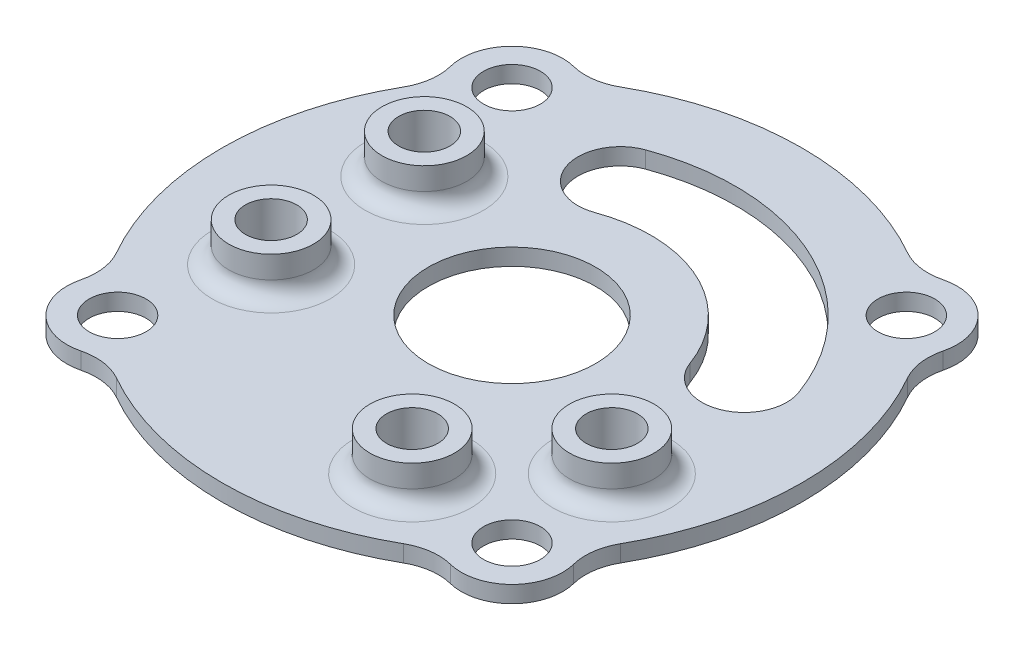
from build123d import *

# Parameters (mm, degrees)
SKETCH1_R           = 5.1
SKETCH1_R_2         = 4.6
BOSS_EXTRUDE1_DEPTH = 3
SKETCH2_R           = 7.6
SKETCH2_R_2         = 4.6
BOSS_EXTRUDE2_DEPTH = 7
FILLET1_R           = 10
FILLET2_R           = 3
SKETCH3_R           = 15
CUT_EXTRUDE1_DEPTH  = 7
CUT_EXTRUDE2_DEPTH  = 7


with BuildPart() as part:
    # Sketch1 → Boss-Extrude1 (new body)
    with BuildSketch(Plane(origin=(0, 0, 0), x_dir=(1, 0, 0), z_dir=(0, 1, 0))):
        with BuildLine():
            ThreePointArc((-42.589636172, 29.834927363), (-52, 0), (-42.589636172, -29.834927363))
            ThreePointArc((-42.589636172, -29.834927363), (-41.790010768, -41.790010768), (-29.834927363, -42.589636172))
            ThreePointArc((-29.834927363, -42.589636172), (0, -52), (29.834927363, -42.589636172))
            ThreePointArc((29.834927363, -42.589636172), (41.790010768, -41.790010768), (42.589636172, -29.834927363))
            ThreePointArc((42.589636172, -29.834927363), (52, 0), (42.589636172, 29.834927363))
            ThreePointArc((42.589636172, 29.834927363), (41.790010768, 41.790010768), (29.834927363, 42.589636172))
            ThreePointArc((29.834927363, 42.589636172), (0, 52), (-29.834927363, 42.589636172))
            ThreePointArc((-29.834927363, 42.589636172), (-41.790010768, 41.790010768), (-42.589636172, 29.834927363))
        make_face()
        with Locations(Location((-35.355339059, -35.355339059, 0), (0, 0, 270))):
            Circle(SKETCH1_R, mode=Mode.SUBTRACT)
        with Locations(Location((-29.455003079, -13.735093507, 0), (0, 0, 270))):
            Circle(SKETCH1_R_2, mode=Mode.SUBTRACT)
        with Locations(Location((15.636875684, -33.53338812, 0), (0, 0, 270))):
            Circle(SKETCH1_R_2, mode=Mode.SUBTRACT)
        with Locations(Location((35.355339059, -35.355339059, 0), (0, 0, 270))):
            Circle(SKETCH1_R, mode=Mode.SUBTRACT)
        with Locations(Location((33.53338812, -15.636875684, 0), (0, 0, 270))):
            Circle(SKETCH1_R_2, mode=Mode.SUBTRACT)
        with Locations(Location((-29.455003079, 13.735093507, 0), (0, 0, 270))):
            Circle(SKETCH1_R_2, mode=Mode.SUBTRACT)
        with Locations(Location((-35.355339059, 35.355339059, 0), (0, 0, 270))):
            Circle(SKETCH1_R, mode=Mode.SUBTRACT)
        with Locations(Location((35.355339059, 35.355339059, 0), (0, 0, 270))):
            Circle(SKETCH1_R, mode=Mode.SUBTRACT)
    extrude(amount=BOSS_EXTRUDE1_DEPTH)

    # Sketch2 → Boss-Extrude2 (add)
    # profile 1 of 4: a face of its own
    with BuildSketch(Plane(origin=(0, 3, 0), x_dir=(1, 0, 0), z_dir=(0, 1, 0))):
        with Locations(Location((-29.455003079, 13.735093507, 0), (0, 0, 270))):
            Circle(SKETCH2_R)
        with Locations(Location((-29.455003079, 13.735093507, 0), (0, 0, 270))):
            Circle(SKETCH2_R_2, mode=Mode.SUBTRACT)
    # profile 2 of 4: a face of its own
    with BuildSketch(Plane(origin=(0, 3, 0), x_dir=(1, 0, 0), z_dir=(0, 1, 0))):
        with Locations(Location((-29.455003079, -13.735093507, 0), (0, 0, 270))):
            Circle(SKETCH2_R)
        with Locations(Location((-29.455003079, -13.735093507, 0), (0, 0, 270))):
            Circle(SKETCH2_R_2, mode=Mode.SUBTRACT)
    # profile 3 of 4: a face of its own
    with BuildSketch(Plane(origin=(0, 3, 0), x_dir=(1, 0, 0), z_dir=(0, 1, 0))):
        with Locations(Location((15.636875684, -33.53338812, 0), (0, 0, 270))):
            Circle(SKETCH2_R)
        with Locations(Location((15.636875684, -33.53338812, 0), (0, 0, 270))):
            Circle(SKETCH2_R_2, mode=Mode.SUBTRACT)
    # profile 4 of 4: a face of its own
    with BuildSketch(Plane(origin=(0, 3, 0), x_dir=(1, 0, 0), z_dir=(0, 1, 0))):
        with Locations(Location((33.53338812, -15.636875684, 0), (0, 0, 270))):
            Circle(SKETCH2_R)
        with Locations(Location((33.53338812, -15.636875684, 0), (0, 0, 270))):
            Circle(SKETCH2_R_2, mode=Mode.SUBTRACT)
    extrude(amount=BOSS_EXTRUDE2_DEPTH)

    # Fillet1
    fillet1_edges = [part.edges().sort_by_distance(p)[0] for p in [
        (-42.589636172, 1.5, 29.834927363),
        (-42.589636172, 1.5, -29.834927363),
        (-29.834927363, 1.5, -42.589636172),
        (29.834927363, 1.5, -42.589636172),
        (42.589636172, 1.5, -29.834927363),
        (42.589636172, 1.5, 29.834927363),
        (29.834927363, 1.5, 42.589636172),
        (-29.834927363, 1.5, 42.589636172),
    ]]
    fillet(fillet1_edges, radius=FILLET1_R)

    # Fillet2
    fillet2_edges = [part.edges().sort_by_distance(p)[0] for p in [
        (-29.455003079, 3, -21.335093507),
        (-29.455003079, 3, 6.135093507),
        (15.636875684, 3, 25.93338812),
        (33.53338812, 3, 8.036875684),
    ]]
    fillet(fillet2_edges, radius=FILLET2_R)

    # Sketch3 → Cut-Extrude1 (cut)
    with BuildSketch(Plane(origin=(0, 3, 0), x_dir=(1, 0, 0), z_dir=(0, 1, 0))):
        with Locations(Location((0, 0, 0), (0, 0, 270))):
            Circle(SKETCH3_R)
    extrude(amount=-CUT_EXTRUDE1_DEPTH, mode=Mode.SUBTRACT)

    # Sketch4 → Cut-Extrude2 (cut)
    with BuildSketch(Plane(origin=(0, 3, 0), x_dir=(1, 0, 0), z_dir=(0, 1, 0))):
        with BuildLine():
            ThreePointArc((37.681674094, 13.715007747), (16.946992296, 36.34294226), (-13.715007747, 37.681674094))
            ThreePointArc((-13.715007747, 37.681674094), (-18.257318576, 27.940657086), (-8.516301569, 23.398346258))
            ThreePointArc((-8.516301569, 23.398346258), (10.523194717, 22.567063897), (23.398346258, 8.516301569))
            ThreePointArc((23.398346258, 8.516301569), (33.139363265, 3.97399074), (37.681674094, 13.715007747))
        make_face()
    extrude(amount=-CUT_EXTRUDE2_DEPTH, mode=Mode.SUBTRACT)


solid = part.part
